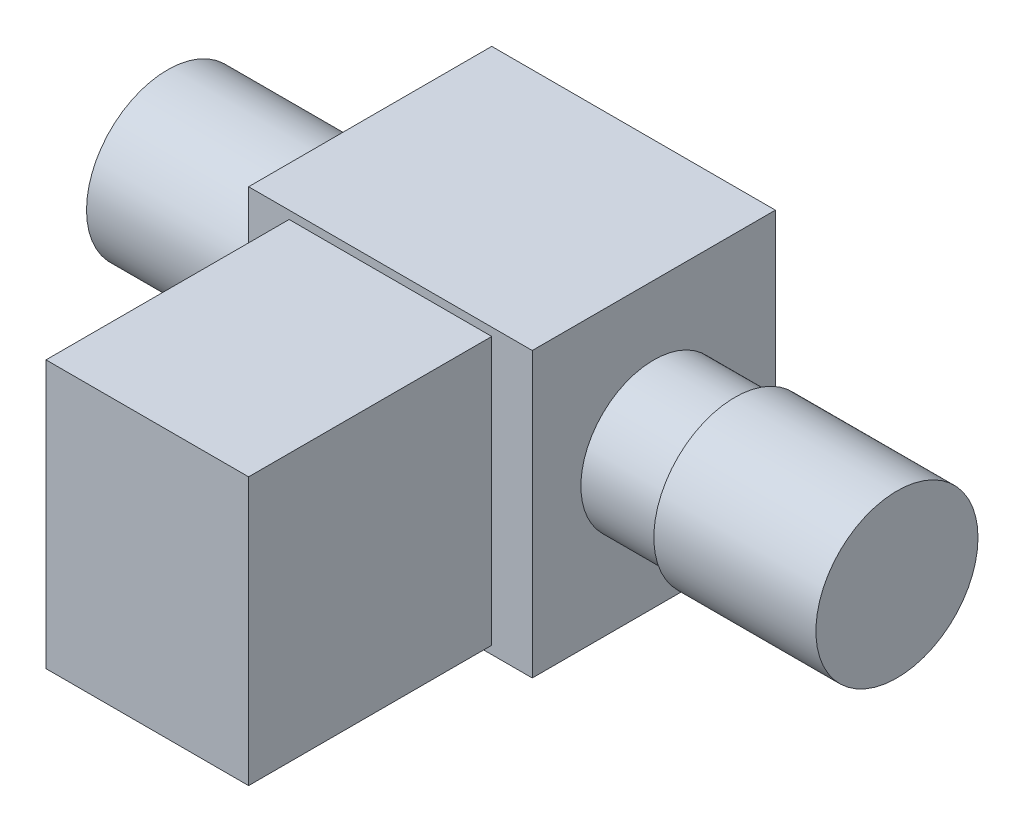
from build123d import *

# Parameters (mm, degrees)
SKETCH1_W           = 35
SKETCH1_H           = 35
BOSS_EXTRUDE1_DEPTH = 30
SKETCH2_W           = 25
SKETCH2_H           = 35
BOSS_EXTRUDE2_DEPTH = 30
SKETCH3_R           = 10
BOSS_EXTRUDE3_DEPTH = 25
BOSS_EXTRUDE4_START = 30
SKETCH4_R           = 10
BOSS_EXTRUDE4_DEPTH = 30
CUT_EXTRUDE1_START  = 10
SKETCH5_R           = 10
SKETCH5_R_2         = 9
CUT_EXTRUDE1_DEPTH  = 10
SKETCH6_W           = 25
SKETCH6_H           = 1
CUT_EXTRUDE2_DEPTH  = 30


with BuildPart() as part:
    # Sketch1 → Boss-Extrude1 (new body)
    with BuildSketch(Plane.XY):
        Rectangle(SKETCH1_W, SKETCH1_H)
    extrude(amount=BOSS_EXTRUDE1_DEPTH)

    # Sketch2 → Boss-Extrude2 (add)
    with BuildSketch(Plane.XY.offset(30)):
        Rectangle(SKETCH2_W, SKETCH2_H)
    extrude(amount=BOSS_EXTRUDE2_DEPTH)

    # Sketch3 → Boss-Extrude3 (add)
    with BuildSketch(Plane.ZY.offset(17.5)):
        with Locations((15, 0)):
            Circle(SKETCH3_R)
    extrude(amount=BOSS_EXTRUDE3_DEPTH)

    # Sketch4 → Boss-Extrude4 (add)
    with BuildSketch(Plane(origin=(17.5, 0, 0), x_dir=(0, 0, -1), z_dir=(1, 0, 0)).offset(BOSS_EXTRUDE4_START)):
        with Locations(Location((-15, 0, 0), (0, 0, 180))):
            Circle(SKETCH4_R)
    extrude(amount=-BOSS_EXTRUDE4_DEPTH)

    # Sketch5 → Cut-Extrude1 (cut)
    with BuildSketch(Plane(origin=(17.5, 0, 0), x_dir=(0, 0, -1), z_dir=(1, 0, 0)).offset(CUT_EXTRUDE1_START)):
        with Locations(Location((-15, 0, 0), (0, 0, 180))):
            Circle(SKETCH5_R)
        with Locations((-15, 0)):
            Circle(SKETCH5_R_2, mode=Mode.SUBTRACT)
    extrude(amount=-CUT_EXTRUDE1_DEPTH, mode=Mode.SUBTRACT)

    # Sketch6 → Cut-Extrude2 (cut)
    with BuildSketch(Plane.XY.offset(60)):
        with Locations((0, 17)):
            Rectangle(SKETCH6_W, SKETCH6_H)
        with Locations((0, -17)):
            Rectangle(SKETCH6_W, SKETCH6_H)
    extrude(amount=-CUT_EXTRUDE2_DEPTH, mode=Mode.SUBTRACT)


solid = part.part
